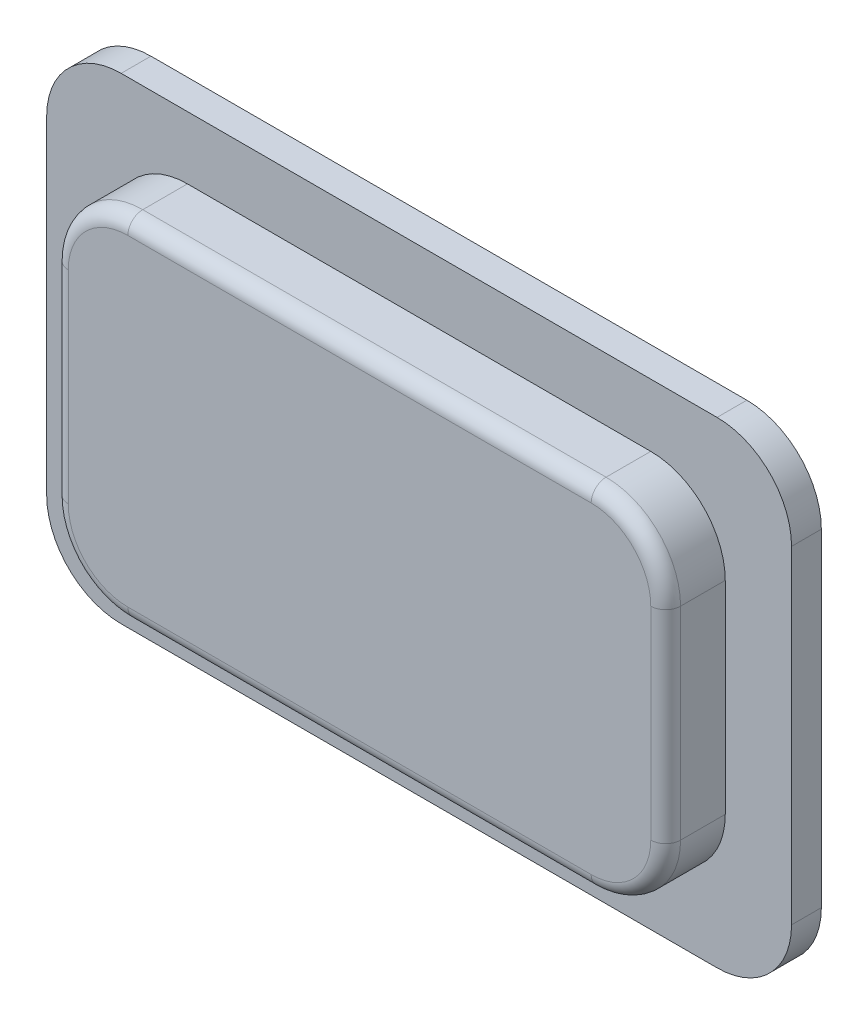
from build123d import *

# Parameters (mm, degrees)
SKETCH1_W           = 25
SKETCH1_H           = 16
BOSS_EXTRUDE1_DEPTH = 1
SKETCH2_W           = 20.55
SKETCH2_H           = 11.8
BOSS_EXTRUDE2_DEPTH = 2
FILLET1_R           = 2.5
FILLET2_R           = 0.5


with BuildPart() as part:
    # Sketch1 → Boss-Extrude1 (new body)
    with BuildSketch(Plane.XY):
        Rectangle(SKETCH1_W, SKETCH1_H)
    extrude(amount=-BOSS_EXTRUDE1_DEPTH)

    # Sketch2 → Boss-Extrude2 (add)
    with BuildSketch(Plane.XY):
        Rectangle(SKETCH2_W, SKETCH2_H)
    extrude(amount=BOSS_EXTRUDE2_DEPTH)

    # Fillet1
    fillet1_edges = [part.edges().sort_by_distance(p)[0] for p in [
        (10.275, -5.9, 1),
        (10.275, 5.9, 1),
        (-10.275, 5.9, 1),
        (-10.275, -5.9, 1),
        (12.5, -8, -0.5),
        (-12.5, -8, -0.5),
        (-12.5, 8, -0.5),
        (12.5, 8, -0.5),
    ]]
    fillet(fillet1_edges, radius=FILLET1_R)

    # Fillet2
    fillet2_edges = [part.edges().sort_by_distance(p)[0] for p in [
        (0, 5.9, 2),
        (10.275, 0, 2),
        (-10.275, 0, 2),
        (0, -5.9, 2),
        (9.542766953, -5.167766953, 2),
        (-9.542766953, -5.167766953, 2),
        (-9.542766953, 5.167766953, 2),
        (9.542766953, 5.167766953, 2),
    ]]
    fillet(fillet2_edges, radius=FILLET2_R)


solid = part.part
